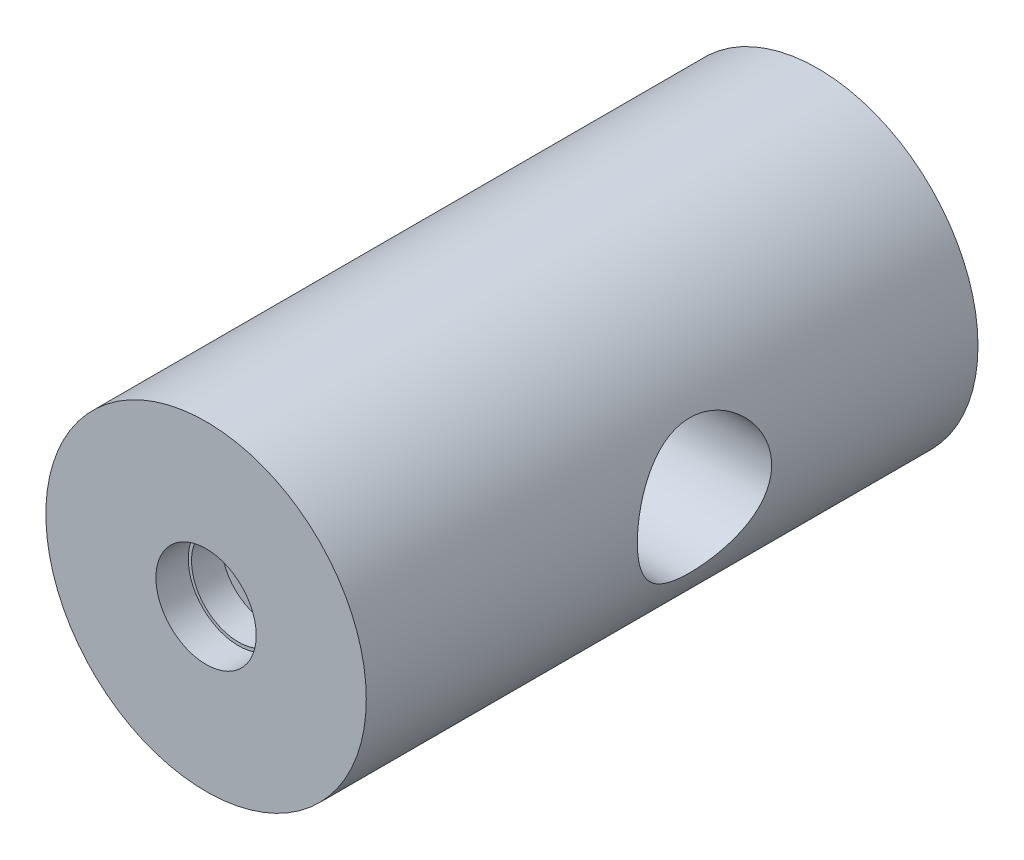
from build123d import *

# Parameters (mm, degrees)
SCHIZZO1_R                    = 9.9
ESTRUSIONE_ESTRUSIONE1_DEPTH  = 29.8
TAGLIO_ESTRUSIONE1_DEPTH      = 33.925066439
TAGLIO_ESTRUSIONE1_DEPTH_BACK = 33.925066439
SCHIZZO3_R                    = 4.15
SCHIZZO5_R                    = 9.9
ESTRUSIONE_ESTRUSIONE2_DEPTH  = 8
SCHIZZO6_R                    = 3.1
TAGLIO_ESTRUSIONE3_DEPTH      = 2
SCHIZZO7_R                    = 2.9
TAGLIO_ESTRUSIONE4_DEPTH      = 1.85
SCHIZZO8_R                    = 1.25
TAGLIO_ESTRUSIONE5_DEPTH      = 10


with BuildPart() as part:
    # Schizzo1 → Estrusione-Estrusione1 (new body)
    with BuildSketch(Plane.XY):
        Circle(SCHIZZO1_R)
    extrude(amount=ESTRUSIONE_ESTRUSIONE1_DEPTH)

    # Schizzo3 → Taglio-Estrusione1 (cut, two sides: drawn at the far end of the back side and taken through both)
    with BuildSketch(Plane(origin=(0, 0, 0), x_dir=(0, 0, -1), z_dir=(1, 0, 0)).offset(-TAGLIO_ESTRUSIONE1_DEPTH_BACK)):
        with Locations((-16.9, 0)):
            Circle(SCHIZZO3_R)
    extrude(amount=TAGLIO_ESTRUSIONE1_DEPTH + TAGLIO_ESTRUSIONE1_DEPTH_BACK, mode=Mode.SUBTRACT)

    # Schizzo5 → Estrusione-Estrusione2 (add)
    with BuildSketch(Plane.XY.offset(29.8)):
        Circle(SCHIZZO5_R)
    extrude(amount=ESTRUSIONE_ESTRUSIONE2_DEPTH)

    # Schizzo6 → Taglio-Estrusione3 (cut)
    with BuildSketch(Plane.XY.offset(37.8)):
        Circle(SCHIZZO6_R)
    extrude(amount=-TAGLIO_ESTRUSIONE3_DEPTH, mode=Mode.SUBTRACT)

    # Schizzo7 → Taglio-Estrusione4 (cut)
    with BuildSketch(Plane.XY.offset(35.8)):
        Circle(SCHIZZO7_R)
    extrude(amount=-TAGLIO_ESTRUSIONE4_DEPTH, mode=Mode.SUBTRACT)

    # Schizzo8 → Taglio-Estrusione5 (cut)
    with BuildSketch(Plane.XY.offset(33.95)):
        Circle(SCHIZZO8_R)
    extrude(amount=-TAGLIO_ESTRUSIONE5_DEPTH, mode=Mode.SUBTRACT)


solid = part.part
